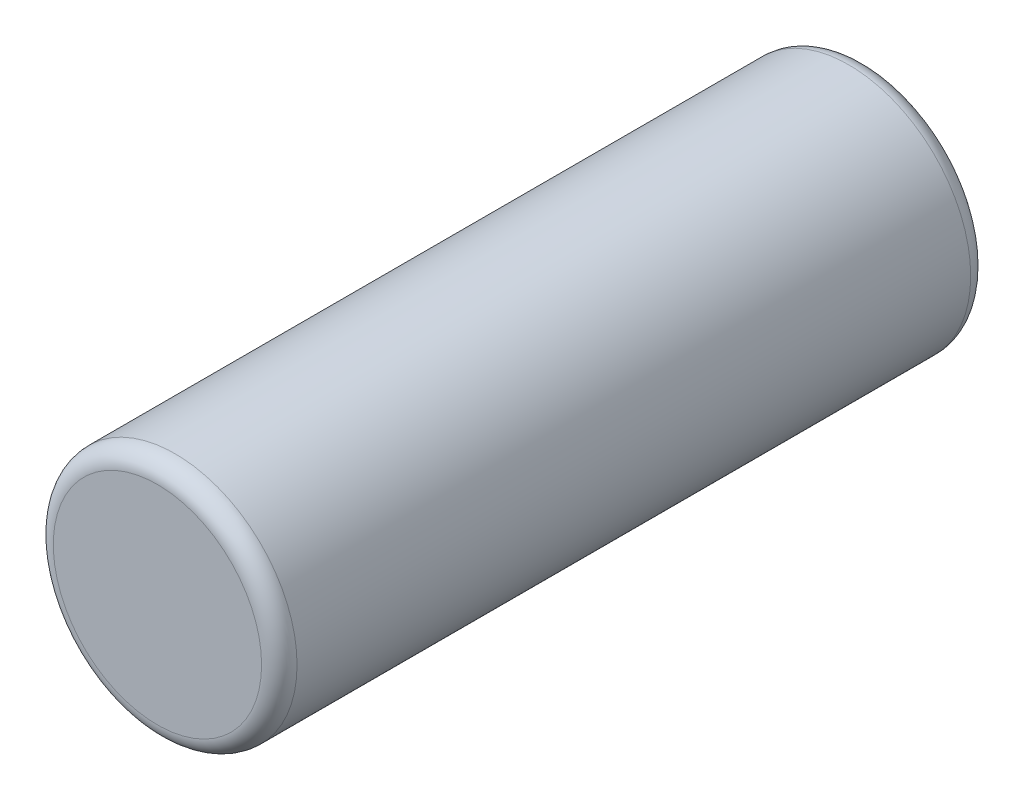
from build123d import *

# Parameters (mm, degrees)
SKETCH1_R           = 1.375
BOSS_EXTRUDE1_DEPTH = 8
FILLET1_R           = 0.2


with BuildPart() as part:
    # Sketch1 → Boss-Extrude1 (new body)
    with BuildSketch(Plane.XY):
        Circle(SKETCH1_R)
    extrude(amount=BOSS_EXTRUDE1_DEPTH)

    # Fillet1
    fillet1_edges = [part.edges().sort_by_distance(p)[0] for p in [
        (-1.375, 0, 0),
        (-1.375, 0, 8),
    ]]
    fillet(fillet1_edges, radius=FILLET1_R)


solid = part.part
